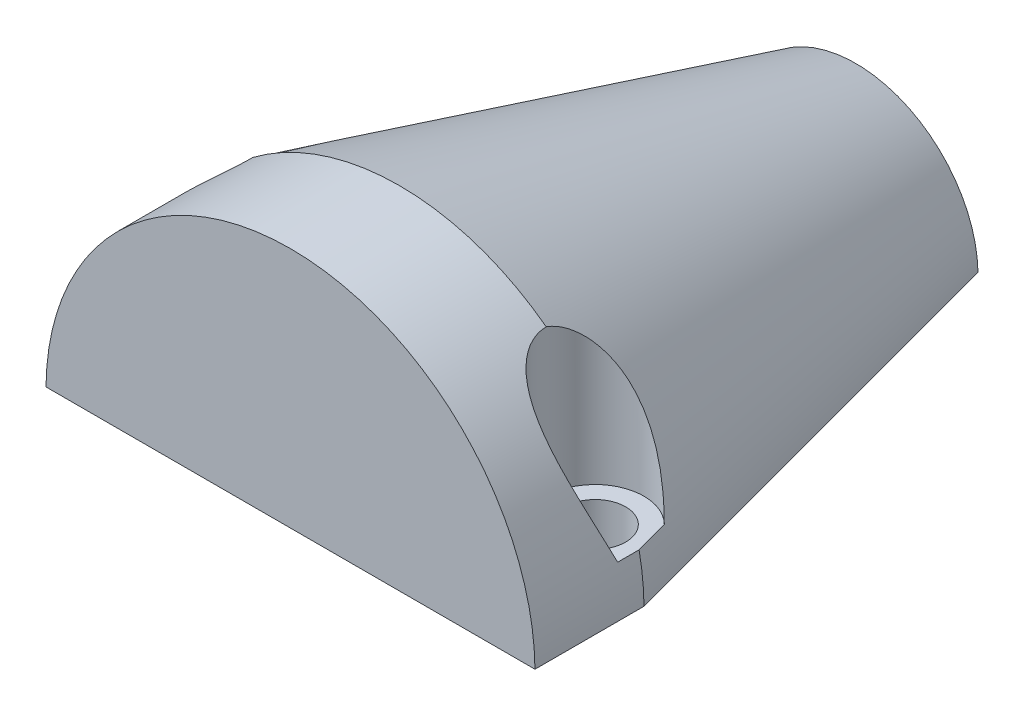
from build123d import *

# Parameters (mm, degrees)
SKETCH1_R           = 12.7
BOSS_EXTRUDE1_DEPTH = 58.7248
CHAMFER3_SIZE       = 6.35
CHAMFER3_SIZE2      = 23.698522628
CHAMFER4_SIZE       = 6.35
CHAMFER4_SIZE2      = 23.698522628
CUT_EXTRUDE1_DEPTH  = 58.7248
CUT_EXTRUDE2_DEPTH  = 58.7248
CUT_EXTRUDE3_DEPTH  = 35.419680486
SKETCH5_R           = 1.5875
CUT_EXTRUDE4_DEPTH  = 62.383681342
SKETCH6_R           = 2.54
CUT_EXTRUDE5_DEPTH  = 10.16


with BuildPart() as part:
    # Sketch1 → Boss-Extrude1 (new body)
    with BuildSketch(Plane.XY):
        Circle(SKETCH1_R)
    extrude(amount=-BOSS_EXTRUDE1_DEPTH)

    # Chamfer3
    chamfer3_edges = [part.edges().sort_by_distance(p)[0] for p in [
        (-12.7, 0, -58.7248),
    ]]
    chamfer3_side = [part.faces().sort_by_distance(p)[0] for p in [
        (0, 0, -58.7248),
    ]]
    chamfer(chamfer3_edges, length=CHAMFER3_SIZE, length2=CHAMFER3_SIZE2, reference=chamfer3_side[0])

    # Chamfer4
    chamfer4_edges = [part.edges().sort_by_distance(p)[0] for p in [
        (-12.7, 0, 0),
    ]]
    chamfer4_side = [part.faces().sort_by_distance(p)[0] for p in [
        (0, 0, 0),
    ]]
    chamfer(chamfer4_edges, length=CHAMFER4_SIZE, length2=CHAMFER4_SIZE2, reference=chamfer4_side[0])

    # Sketch2 → Cut-Extrude1 (cut)
    with BuildSketch(Plane(origin=(0, 0, 0), x_dir=(1, 0, 0), z_dir=(0, 1, 0))):
        Polygon((-6.35, 0), (-12.7, 23.698522628), (-12.7, 35.026277372), (-6.35, 58.7248), (6.35, 58.7248), (12.7, 35.026277372), (12.7, 23.698522628), (6.35, 0), align=None)
    extrude(amount=-CUT_EXTRUDE1_DEPTH, mode=Mode.SUBTRACT)

    # Sketch3 → Cut-Extrude2 (cut)
    with BuildSketch(Plane.XY):
        with BuildLine():
            Line((-12.7, 0), (12.7, 0))
            ThreePointArc((12.7, 0), (12.699841245, 0.063500794), (12.699364984, 0.127))
            Line((12.699364984, 0.127), (0, 0.127))
            Line((0, 0.127), (-12.699364984, 0.127))
            ThreePointArc((-12.699364984, 0.127), (-12.699841245, 0.063500794), (-12.7, 0))
        make_face()
    extrude(amount=-CUT_EXTRUDE2_DEPTH, mode=Mode.SUBTRACT)

    # Sketch4 → Cut-Extrude3 (cut, through all)
    with BuildSketch(Plane(origin=(0, 0, -29.3624), x_dir=(-1, 0, 0), z_dir=(0, 0, -1))):
        with BuildLine():
            Line((0, 0.127), (-12.699364984, 0.127))
            ThreePointArc((-12.699364984, 0.127), (0, 12.826364984), (12.699364984, 0.127))
            Line((12.699364984, 0.127), (0, 0.127))
        make_face()
    extrude(amount=-CUT_EXTRUDE3_DEPTH, mode=Mode.SUBTRACT)

    # Sketch5 → Cut-Extrude4 (cut, through all)
    with BuildSketch(Plane(origin=(0, 12.7, 0), x_dir=(-1, 0, 0), z_dir=(0, -1, 0))):
        with Locations((-10.16, 35.026277372)):
            Circle(SKETCH5_R)
        with Locations(Location((10.16, 35.026277372, 0), (0, 0, 270))):
            Circle(SKETCH5_R)
    extrude(amount=CUT_EXTRUDE4_DEPTH, mode=Mode.SUBTRACT)

    # Sketch6 → Cut-Extrude5 (cut)
    with BuildSketch(Plane(origin=(0, 12.7, 0), x_dir=(-1, 0, 0), z_dir=(0, -1, 0))):
        with Locations((-10.16, 35.026277372)):
            Circle(SKETCH6_R)
        with Locations((10.16, 35.026277372)):
            Circle(SKETCH6_R)
    extrude(amount=CUT_EXTRUDE5_DEPTH, mode=Mode.SUBTRACT)


solid = part.part
